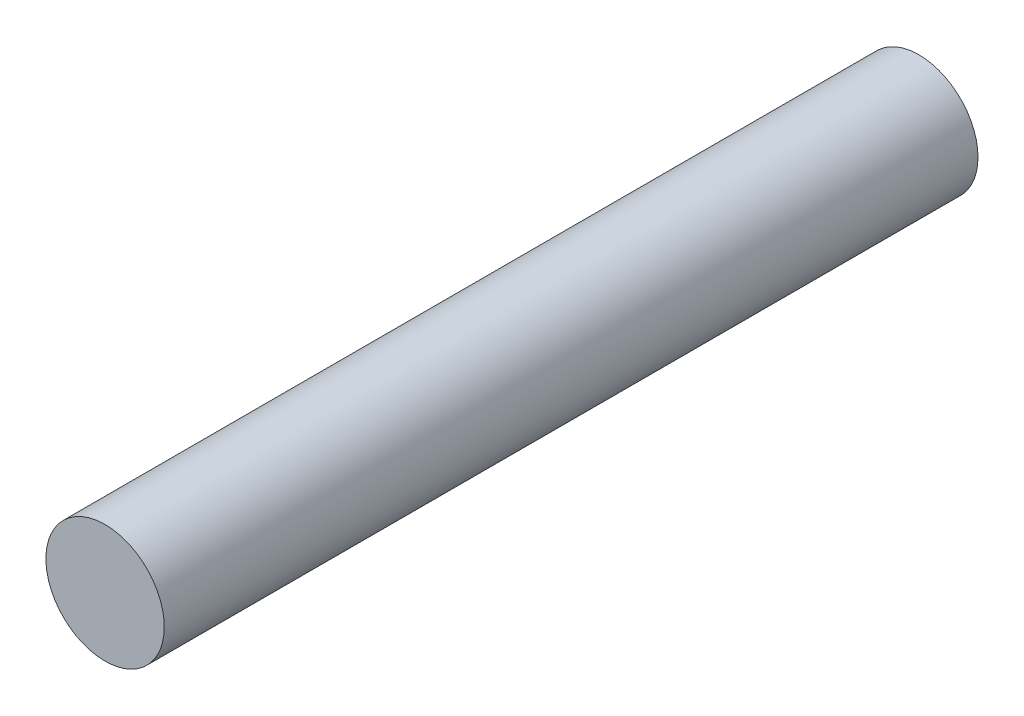
from build123d import *

# Parameters (mm, degrees)
SKETCH_1_R      = 4
EXTRUDE_1_DEPTH = 55


with BuildPart() as part:
    # 草图1 → 凸台-拉伸1 (new body)
    with BuildSketch(Plane.XY):
        Circle(SKETCH_1_R)
    extrude(amount=EXTRUDE_1_DEPTH)


solid = part.part
